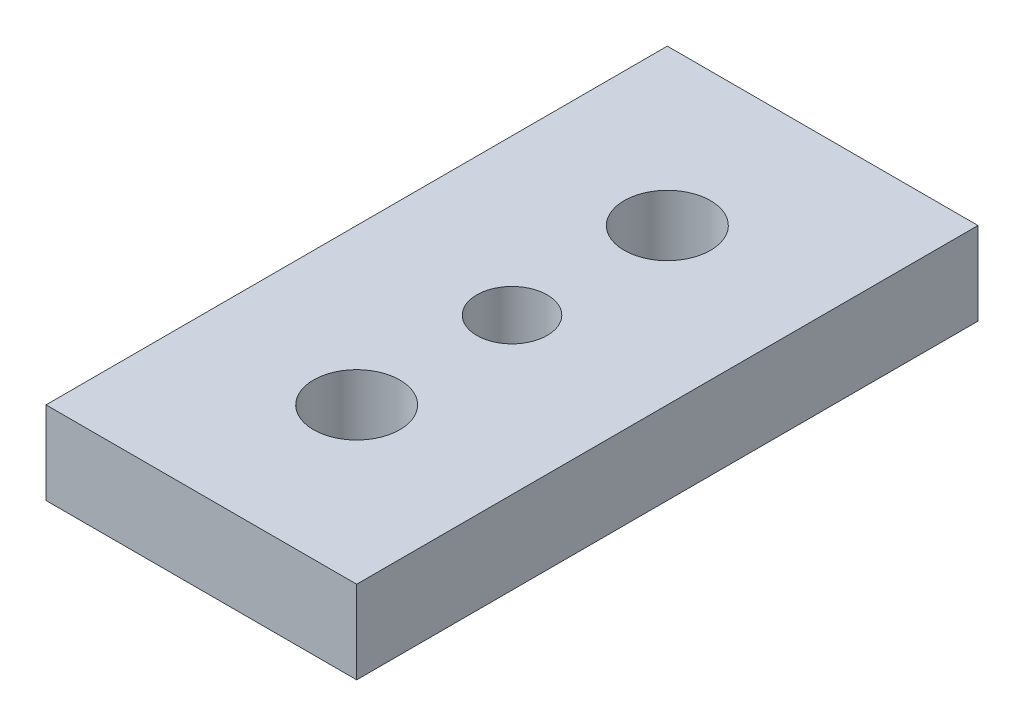
from build123d import *

# Parameters (mm, degrees)
SKETCH_1_W              = 45
SKETCH_1_H              = 90
SKETCH_1_R              = 6.25
EXTRUDE_1_DEPTH         = 12
HOLE_WIZARD_M12_1_D     = 10.2
HOLE_WIZARD_M12_1_DEPTH = 29.25
HOLE_WIZARD_M12_1_TIP   = 3.064389157


with BuildPart() as part:
    # 草图1 → 凸台-拉伸1 (new body)
    with BuildSketch(Plane(origin=(0, 0, 0), x_dir=(1, 0, 0), z_dir=(0, 1, 0))):
        with Locations((22.5, 45)):
            Rectangle(SKETCH_1_W, SKETCH_1_H)
        with Locations(Location((22.5, 67.5, 0), (0, 0, 270))):
            Circle(SKETCH_1_R, mode=Mode.SUBTRACT)
        with Locations(Location((22.5, 22.5, 0), (0, 0, 270))):
            Circle(SKETCH_1_R, mode=Mode.SUBTRACT)
    extrude(amount=EXTRUDE_1_DEPTH)

    # M12 螺纹孔1
    with Locations(Plane(origin=(22.5, 12, -45), x_dir=(0, 0, 1), z_dir=(0, 1, 0))):
        with Locations((0, 0)):
            Hole(HOLE_WIZARD_M12_1_D / 2, depth=HOLE_WIZARD_M12_1_DEPTH)
            with Locations((0, 0, -(HOLE_WIZARD_M12_1_DEPTH + HOLE_WIZARD_M12_1_TIP / 2))):  # 118° drill point
                Cone(0, HOLE_WIZARD_M12_1_D / 2, HOLE_WIZARD_M12_1_TIP, mode=Mode.SUBTRACT)


solid = part.part
